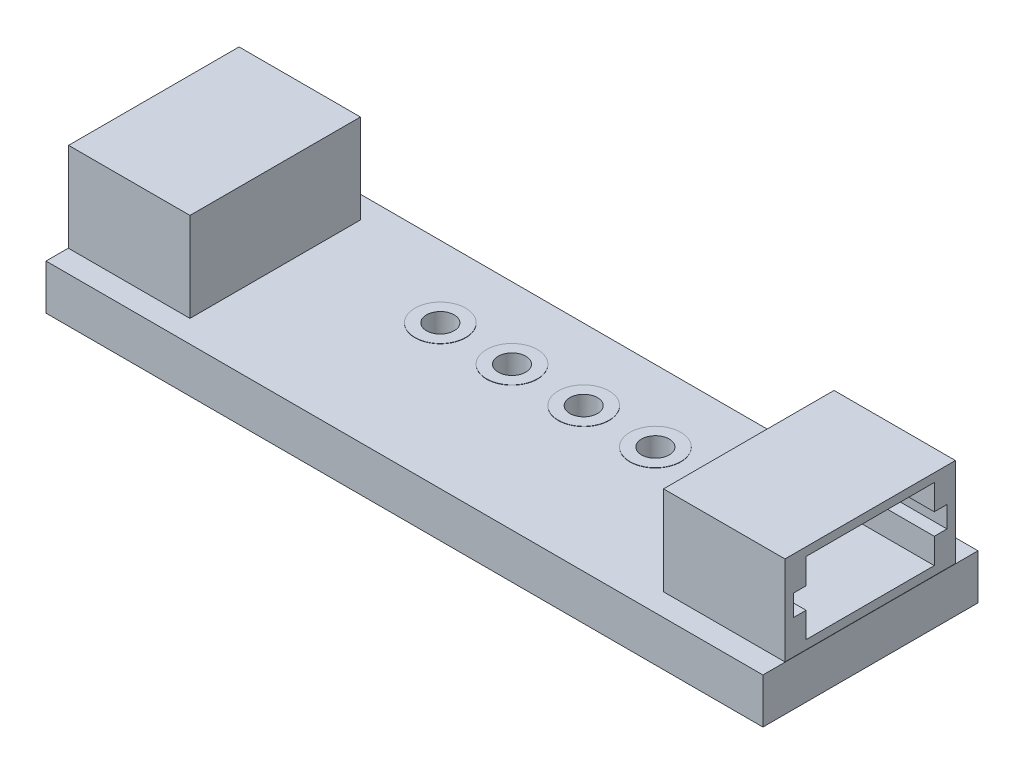
from build123d import *

# Parameters (mm, degrees)
SKETCH1_W           = 25.4
SKETCH1_H           = 7.62
SKETCH1_R           = 0.5
BOSS_EXTRUDE1_DEPTH = 1.6
SKETCH2_R           = 0.9
SKETCH2_R_2         = 0.49
BOSS_EXTRUDE2_DEPTH = 1.62
SKETCH3_W           = 4.3
SKETCH3_H           = 6.04
BOSS_EXTRUDE3_DEPTH = 3.16
CUT_EXTRUDE1_DEPTH  = 3.5


with BuildPart() as part:
    # Sketch1 → Boss-Extrude1 (new body)
    with BuildSketch(Plane(origin=(0, 0, 0), x_dir=(1, 0, 0), z_dir=(0, 1, 0))):
        Rectangle(SKETCH1_W, SKETCH1_H)
        with Locations(Location((-3.81, 1.27, 0), (0, 0, 270))):
            Circle(SKETCH1_R, mode=Mode.SUBTRACT)
        with Locations(Location((-1.27, 1.27, 0), (0, 0, 270))):
            Circle(SKETCH1_R, mode=Mode.SUBTRACT)
        with Locations(Location((1.27, 1.27, 0), (0, 0, 270))):
            Circle(SKETCH1_R, mode=Mode.SUBTRACT)
        with Locations(Location((3.81, 1.27, 0), (0, 0, 270))):
            Circle(SKETCH1_R, mode=Mode.SUBTRACT)
    extrude(amount=BOSS_EXTRUDE1_DEPTH)

    # Sketch2 → Boss-Extrude2 (add)
    # profile 1 of 4: a face of its own
    with BuildSketch(Plane(origin=(0, 1.61, 0), x_dir=(1, 0, 0), z_dir=(0, 1, 0))):
        with Locations(Location((-3.81, 1.27, 0), (0, 0, 270))):
            Circle(SKETCH2_R)
        with Locations(Location((-3.81, 1.27, 0), (0, 0, 270))):
            Circle(SKETCH2_R_2, mode=Mode.SUBTRACT)
    # profile 2 of 4: a face of its own
    with BuildSketch(Plane(origin=(0, 1.61, 0), x_dir=(1, 0, 0), z_dir=(0, 1, 0))):
        with Locations(Location((1.27, 1.27, 0), (0, 0, 270))):
            Circle(SKETCH2_R)
        with Locations(Location((1.27, 1.27, 0), (0, 0, 270))):
            Circle(SKETCH2_R_2, mode=Mode.SUBTRACT)
    # profile 3 of 4: a face of its own
    with BuildSketch(Plane(origin=(0, 1.61, 0), x_dir=(1, 0, 0), z_dir=(0, 1, 0))):
        with Locations(Location((-1.27, 1.27, 0), (0, 0, 270))):
            Circle(SKETCH2_R)
        with Locations(Location((-1.27, 1.27, 0), (0, 0, 270))):
            Circle(SKETCH2_R_2, mode=Mode.SUBTRACT)
    # profile 4 of 4: a face of its own
    with BuildSketch(Plane(origin=(0, 1.61, 0), x_dir=(1, 0, 0), z_dir=(0, 1, 0))):
        with Locations(Location((3.81, 1.27, 0), (0, 0, 270))):
            Circle(SKETCH2_R)
        with Locations(Location((3.81, 1.27, 0), (0, 0, 270))):
            Circle(SKETCH2_R_2, mode=Mode.SUBTRACT)
    extrude(amount=-BOSS_EXTRUDE2_DEPTH)

    # Sketch3 → Boss-Extrude3 (add)
    with BuildSketch(Plane(origin=(0, 1.6, 0), x_dir=(1, 0, 0), z_dir=(0, 1, 0))):
        with Locations((-10.54, 0)):
            Rectangle(SKETCH3_W, SKETCH3_H)
        with Locations((10.54, 0)):
            Rectangle(SKETCH3_W, SKETCH3_H)
    extrude(amount=BOSS_EXTRUDE3_DEPTH)

    # Sketch4 → Cut-Extrude1 (cut)
    with BuildSketch(Plane.ZY.offset(12.69)):
        Polygon((2.27, 4.46), (-2.27, 4.46), (-2.27, 3.56), (-2.72, 3.56), (-2.72, 2.81), (-2.27, 2.81), (-2.27, 1.91), (2.27, 1.91), (2.27, 2.81), (2.72, 2.81), (2.72, 3.56), (2.27, 3.56), align=None)
    cut_extrude1 = extrude(amount=-CUT_EXTRUDE1_DEPTH, mode=Mode.SUBTRACT)

    # Mirror1: Cut-Extrude1 across plane
    add(cut_extrude1.mirror(Plane(origin=(0, 0, 0), x_dir=(0, 0, 1), z_dir=(1, 0, 0))), mode=Mode.SUBTRACT)


solid = part.part
